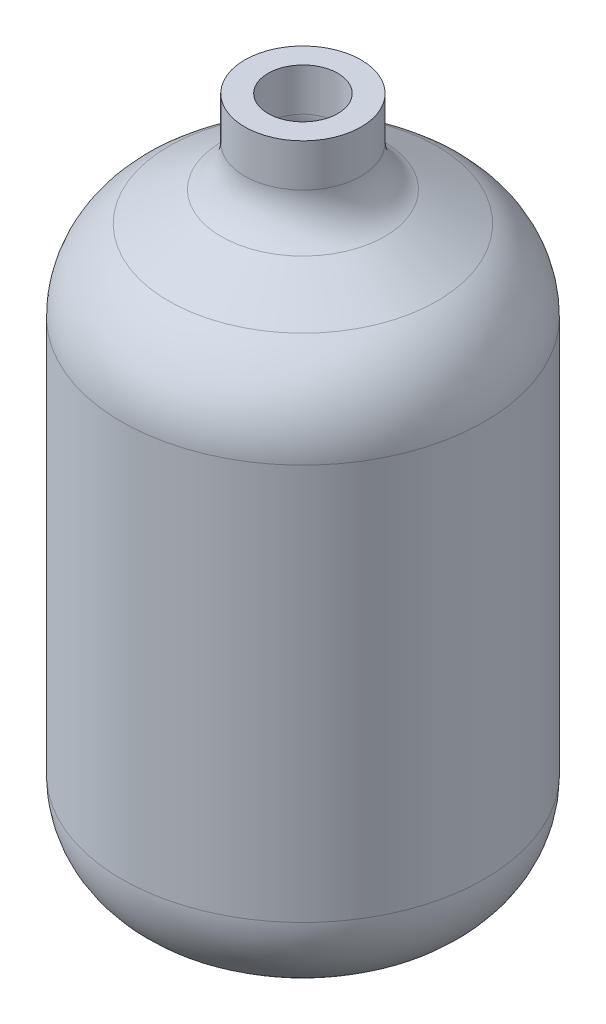
from build123d import *

# Parameters (mm, degrees)
SHELL1_T = -6.35


with BuildPart() as part:
    # Sketch1 → Revolve1 (revolve)
    with BuildSketch(Plane.XY, mode=Mode.PRIVATE) as revolve1_sk:
        with BuildLine():
            Line((-10.034098989, -23.334027888), (-34.164098989, -12.957644961))
            ThreePointArc((-34.164098989, -12.957644961), (-45.343511193, -3.593117524), (-49.53, 10.376382927))
            Line((-49.53, 10.376382927), (-49.53, 118.540573173))
            ThreePointArc((-49.53, 118.540573173), (-46.072705707, 131.334230439), (-36.641994784, 140.645097292))
            Line((-36.641994784, 140.645097292), (-22.319002608, 148.752451354))
            ThreePointArc((-22.319002608, 148.752451354), (-17.603647146, 153.40788478), (-15.875, 159.804713413))
            Line((-15.875, 159.804713413), (-15.875, 171.45))
            Line((-15.875, 171.45), (0, 171.45))
            Line((0, 171.45), (0, -25.4))
            ThreePointArc((0, -25.4), (-5.122289119, -24.878146116), (-10.034098989, -23.334027888))
        make_face()
    revolve(revolve1_sk.sketch.rotate(Axis((0, 0, 0), (0, 1, 0)), 270), axis=Axis((0, 0, 0), (0, 1, 0)))

    # Shell1
    shell1_openings = [part.faces().sort_by_distance(p)[0] for p in [
        (0, 171.45, 0),
    ]]
    offset(amount=SHELL1_T, openings=shell1_openings, kind=Kind.INTERSECTION)


solid = part.part
